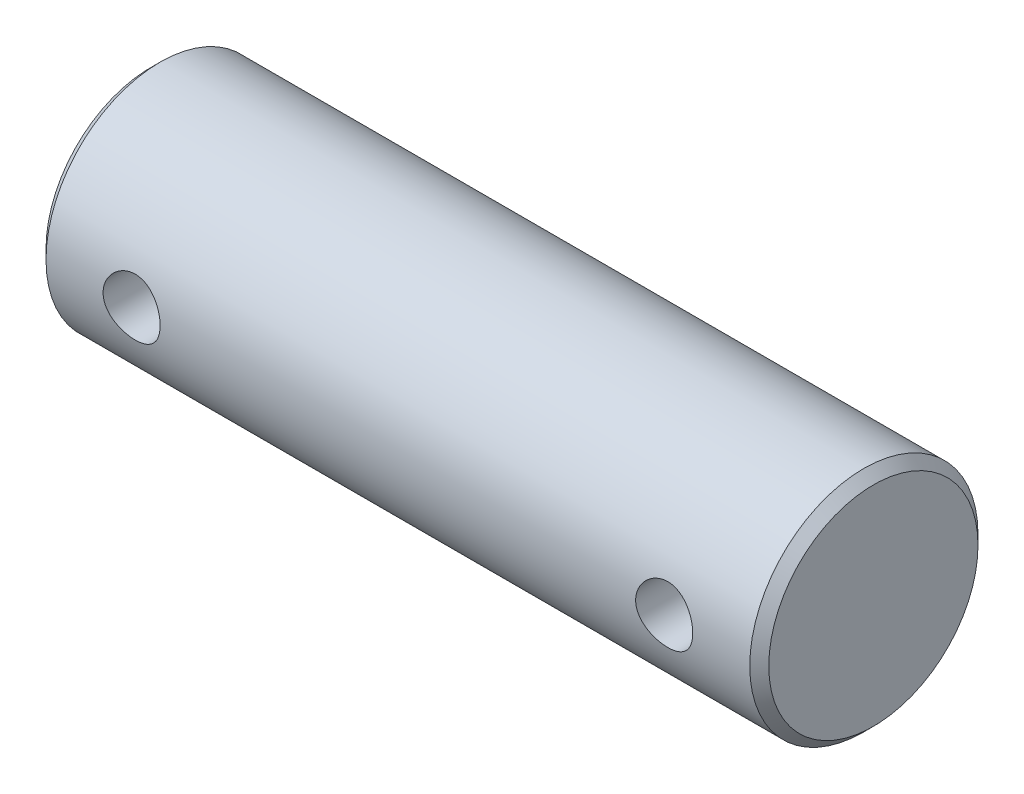
from build123d import *

# Parameters (mm, degrees)
SKETCH1_R               = 6
BOSS_EXTRUDE1_DEPTH     = 38
CHAMFER1_SIZE           = 0.5
CUT_EXTRUDE1_DEPTH      = 39.935844668
CUT_EXTRUDE1_DEPTH_BACK = 39.935844668
SKETCH2_R               = 1.5


with BuildPart() as part:
    # Sketch1 → Boss-Extrude1 (new body)
    with BuildSketch(Plane(origin=(0, 0, 0), x_dir=(0, 0, -1), z_dir=(1, 0, 0))):
        Circle(SKETCH1_R)
    extrude(amount=BOSS_EXTRUDE1_DEPTH)

    # Chamfer1
    chamfer1_edges = [part.edges().sort_by_distance(p)[0] for p in [
        (0, 0, 6),
        (38, 0, 6),
    ]]
    chamfer(chamfer1_edges, length=CHAMFER1_SIZE)

    # Sketch2 → Cut-Extrude1 (cut, two sides: drawn at the far end of the back side and taken through both)
    with BuildSketch(Plane.XY.offset(-CUT_EXTRUDE1_DEPTH_BACK)):
        with Locations((5, 0)):
            Circle(SKETCH2_R)
        with Locations((33, 0)):
            Circle(SKETCH2_R)
    extrude(amount=CUT_EXTRUDE1_DEPTH + CUT_EXTRUDE1_DEPTH_BACK, mode=Mode.SUBTRACT)


solid = part.part
